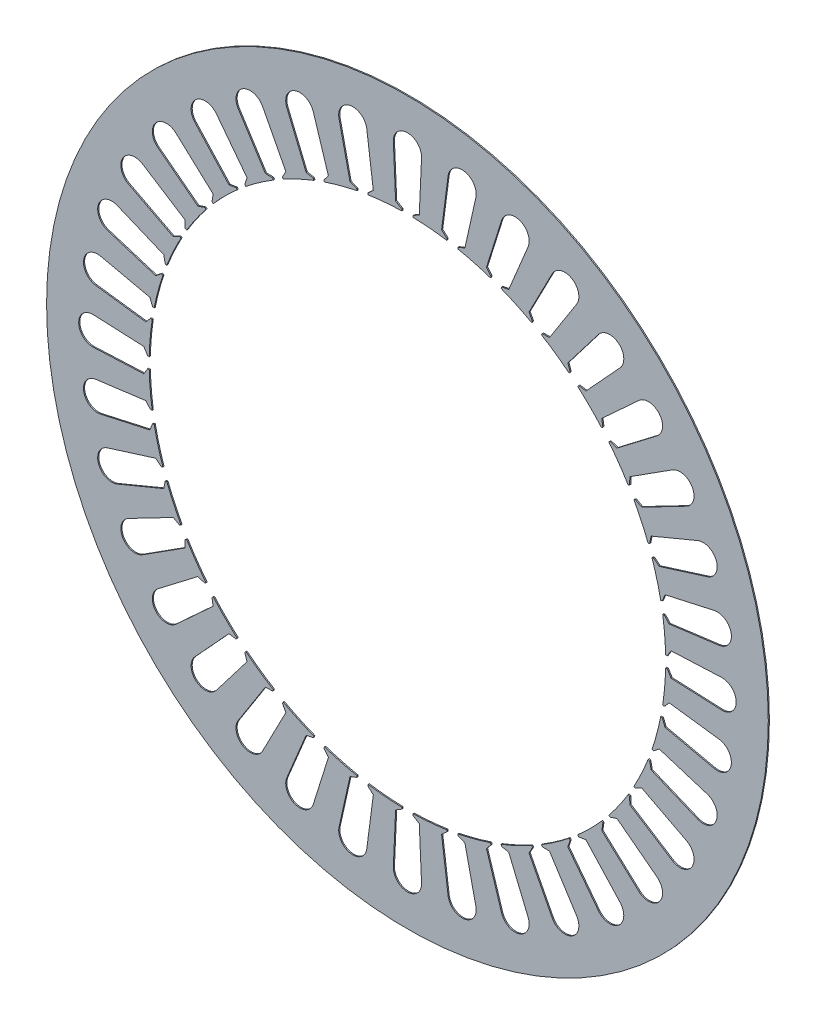
from build123d import *

# Parameters (mm, degrees)
STATOR_SKETCH_R     = 64
BOSS_EXTRUDE1_DEPTH = 0.1


with BuildPart() as part:
    # Stator sketch → Boss-Extrude1 (new, symmetric)
    with BuildSketch(Plane.XY):
        Circle(STATOR_SKETCH_R)
        with BuildLine():
            Line((2.098931216, 46.753917075), (2.5, 55.687767093))
            ThreePointArc((2.5, 55.687767093), (0, 58.302517977), (-2.5, 55.687767093))
            Line((-2.5, 55.687767093), (-2.098931216, 46.753917075))
            Line((-2.098931216, 46.753917075), (-1.00655178, 46.089081668))
            Line((-1.00655178, 46.089081668), (-1, 45.789081668))
            ThreePointArc((-1, 45.789081668), (-3.991733018, 45.625717173), (-6.966382836, 45.267090808))
            Line((-6.966382836, 45.267090808), (-7.012025045, 45.563670838))
            Line((-7.012025045, 45.563670838), (-6.051688764, 46.4080956))
            Line((-6.051688764, 46.4080956), (-7.208059891, 55.275865225))
            ThreePointArc((-7.208059891, 55.275865225), (-10.124126, 57.416771724), (-12.132098657, 54.407624337))
            Line((-12.132098657, 54.407624337), (-10.185776233, 45.679144438))
            Line((-10.185776233, 45.679144438), (-8.994545039, 45.214099074))
            Line((-8.994545039, 45.214099074), (-8.935998342, 44.919794452))
            ThreePointArc((-8.935998342, 44.919794452), (-11.853912266, 44.239402844), (-14.721095654, 43.369682299))
            Line((-14.721095654, 43.369682299), (-14.817545038, 43.653830926))
            Line((-14.817545038, 43.653830926), (-14.018431244, 44.652187623))
            Line((-14.018431244, 44.652187623), (-16.697106531, 53.184434163))
            ThreePointArc((-16.697106531, 53.184434163), (-19.940635555, 54.786445916), (-21.395569635, 51.474333447))
            Line((-21.395569635, 51.474333447), (-17.963131594, 43.216434113))
            Line((-17.963131594, 43.216434113), (-16.709243598, 42.965308958))
            Line((-16.709243598, 42.965308958), (-16.600480896, 42.685642013))
            ThreePointArc((-16.600480896, 42.685642013), (-19.355916388, 41.508896646), (-22.02851543, 40.15450794))
            Line((-22.02851543, 40.15450794), (-22.172841422, 40.417591452))
            Line((-22.172841422, 40.417591452), (-21.559230784, 41.539545521))
            Line((-21.559230784, 41.539545521), (-25.678820037, 49.477020982))
            ThreePointArc((-25.678820037, 49.477020982), (-29.151258989, 50.491461673), (-30.008947056, 46.977020982))
            Line((-30.008947056, 46.977020982), (-25.194686291, 39.440614305))
            Line((-25.194686291, 39.440614305), (-23.916240246, 39.411039671))
            Line((-23.916240246, 39.411039671), (-23.760566238, 39.15450794))
            ThreePointArc((-23.760566238, 39.15450794), (-26.269800785, 37.517163628), (-28.666609912, 35.719259177))
            Line((-28.666609912, 35.719259177), (-28.85442724, 35.953283913))
            Line((-28.85442724, 35.953283913), (-28.444964006, 37.164745348))
            Line((-28.444964006, 37.164745348), (-33.880295591, 44.266273555))
            ThreePointArc((-33.880295591, 44.266273555), (-37.476136169, 44.662319916), (-37.710517806, 41.052335507))
            Line((-37.710517806, 41.052335507), (-31.660713194, 34.46641139))
            Line((-31.660713194, 34.46641139), (-30.396554036, 34.659285887))
            Line((-30.396554036, 34.659285887), (-30.198698798, 34.433683958))
            ThreePointArc((-30.198698798, 34.433683958), (-32.385490578, 32.385490578), (-34.433683958, 30.198698798))
            Line((-34.433683958, 30.198698798), (-34.659285887, 30.396554036))
            Line((-34.659285887, 30.396554036), (-34.46641139, 31.660713194))
            Line((-34.46641139, 31.660713194), (-41.052335507, 37.710517806))
            ThreePointArc((-41.052335507, 37.710517806), (-44.662319916, 37.476136169), (-44.266273555, 33.880295591))
            Line((-44.266273555, 33.880295591), (-37.164745348, 28.444964006))
            Line((-37.164745348, 28.444964006), (-35.953283913, 28.85442724))
            Line((-35.953283913, 28.85442724), (-35.719259177, 28.666609912))
            ThreePointArc((-35.719259177, 28.666609912), (-37.517163628, 26.269800785), (-39.15450794, 23.760566238))
            Line((-39.15450794, 23.760566238), (-39.411039671, 23.916240246))
            Line((-39.411039671, 23.916240246), (-39.440614305, 25.194686291))
            Line((-39.440614305, 25.194686291), (-46.977020982, 30.008947056))
            ThreePointArc((-46.977020982, 30.008947056), (-50.491461673, 29.151258989), (-49.477020982, 25.678820037))
            Line((-49.477020982, 25.678820037), (-41.539545521, 21.559230784))
            Line((-41.539545521, 21.559230784), (-40.417591452, 22.172841422))
            Line((-40.417591452, 22.172841422), (-40.15450794, 22.02851543))
            ThreePointArc((-40.15450794, 22.02851543), (-41.508896646, 19.355916388), (-42.685642013, 16.600480896))
            Line((-42.685642013, 16.600480896), (-42.965308958, 16.709243598))
            Line((-42.965308958, 16.709243598), (-43.216434113, 17.963131594))
            Line((-43.216434113, 17.963131594), (-51.474333447, 21.395569635))
            ThreePointArc((-51.474333447, 21.395569635), (-54.786445916, 19.940635555), (-53.184434163, 16.697106531))
            Line((-53.184434163, 16.697106531), (-44.652187623, 14.018431244))
            Line((-44.652187623, 14.018431244), (-43.653830926, 14.817545038))
            Line((-43.653830926, 14.817545038), (-43.369682299, 14.721095654))
            ThreePointArc((-43.369682299, 14.721095654), (-44.239402844, 11.853912266), (-44.919794452, 8.935998342))
            Line((-44.919794452, 8.935998342), (-45.214099074, 8.994545039))
            Line((-45.214099074, 8.994545039), (-45.679144438, 10.185776233))
            Line((-45.679144438, 10.185776233), (-54.407624337, 12.132098657))
            ThreePointArc((-54.407624337, 12.132098657), (-57.416771724, 10.124126), (-55.275865225, 7.208059891))
            Line((-55.275865225, 7.208059891), (-46.4080956, 6.051688764))
            Line((-46.4080956, 6.051688764), (-45.563670838, 7.012025045))
            Line((-45.563670838, 7.012025045), (-45.267090808, 6.966382836))
            ThreePointArc((-45.267090808, 6.966382836), (-45.625717173, 3.991733018), (-45.789081668, 1))
            Line((-45.789081668, 1), (-46.089081668, 1.00655178))
            Line((-46.089081668, 1.00655178), (-46.753917075, 2.098931216))
            Line((-46.753917075, 2.098931216), (-55.687767093, 2.5))
            ThreePointArc((-55.687767093, 2.5), (-58.302517977, 0), (-55.687767093, -2.5))
            Line((-55.687767093, -2.5), (-46.753917075, -2.098931216))
            Line((-46.753917075, -2.098931216), (-46.089081668, -1.00655178))
            Line((-46.089081668, -1.00655178), (-45.789081668, -1))
            ThreePointArc((-45.789081668, -1), (-45.625717173, -3.991733018), (-45.267090808, -6.966382836))
            Line((-45.267090808, -6.966382836), (-45.563670838, -7.012025045))
            Line((-45.563670838, -7.012025045), (-46.4080956, -6.051688764))
            Line((-46.4080956, -6.051688764), (-55.275865225, -7.208059891))
            ThreePointArc((-55.275865225, -7.208059891), (-57.416771724, -10.124126), (-54.407624337, -12.132098657))
            Line((-54.407624337, -12.132098657), (-45.679144438, -10.185776233))
            Line((-45.679144438, -10.185776233), (-45.214099074, -8.994545039))
            Line((-45.214099074, -8.994545039), (-44.919794452, -8.935998342))
            ThreePointArc((-44.919794452, -8.935998342), (-44.239402844, -11.853912266), (-43.369682299, -14.721095654))
            Line((-43.369682299, -14.721095654), (-43.653830926, -14.817545038))
            Line((-43.653830926, -14.817545038), (-44.652187623, -14.018431244))
            Line((-44.652187623, -14.018431244), (-53.184434163, -16.697106531))
            ThreePointArc((-53.184434163, -16.697106531), (-54.786445916, -19.940635555), (-51.474333447, -21.395569635))
            Line((-51.474333447, -21.395569635), (-43.216434113, -17.963131594))
            Line((-43.216434113, -17.963131594), (-42.965308958, -16.709243598))
            Line((-42.965308958, -16.709243598), (-42.685642013, -16.600480896))
            ThreePointArc((-42.685642013, -16.600480896), (-41.508896646, -19.355916388), (-40.15450794, -22.02851543))
            Line((-40.15450794, -22.02851543), (-40.417591452, -22.172841422))
            Line((-40.417591452, -22.172841422), (-41.539545521, -21.559230784))
            Line((-41.539545521, -21.559230784), (-49.477020982, -25.678820037))
            ThreePointArc((-49.477020982, -25.678820037), (-50.491461673, -29.151258989), (-46.977020982, -30.008947056))
            Line((-46.977020982, -30.008947056), (-39.440614305, -25.194686291))
            Line((-39.440614305, -25.194686291), (-39.411039671, -23.916240246))
            Line((-39.411039671, -23.916240246), (-39.15450794, -23.760566238))
            ThreePointArc((-39.15450794, -23.760566238), (-37.517163628, -26.269800785), (-35.719259177, -28.666609912))
            Line((-35.719259177, -28.666609912), (-35.953283913, -28.85442724))
            Line((-35.953283913, -28.85442724), (-37.164745348, -28.444964006))
            Line((-37.164745348, -28.444964006), (-44.266273555, -33.880295591))
            ThreePointArc((-44.266273555, -33.880295591), (-44.662319916, -37.476136169), (-41.052335507, -37.710517806))
            Line((-41.052335507, -37.710517806), (-34.46641139, -31.660713194))
            Line((-34.46641139, -31.660713194), (-34.659285887, -30.396554036))
            Line((-34.659285887, -30.396554036), (-34.433683958, -30.198698798))
            ThreePointArc((-34.433683958, -30.198698798), (-32.385490578, -32.385490578), (-30.198698798, -34.433683958))
            Line((-30.198698798, -34.433683958), (-30.396554036, -34.659285887))
            Line((-30.396554036, -34.659285887), (-31.660713194, -34.46641139))
            Line((-31.660713194, -34.46641139), (-37.710517806, -41.052335507))
            ThreePointArc((-37.710517806, -41.052335507), (-37.476136169, -44.662319916), (-33.880295591, -44.266273555))
            Line((-33.880295591, -44.266273555), (-28.444964006, -37.164745348))
            Line((-28.444964006, -37.164745348), (-28.85442724, -35.953283913))
            Line((-28.85442724, -35.953283913), (-28.666609912, -35.719259177))
            ThreePointArc((-28.666609912, -35.719259177), (-26.269800785, -37.517163628), (-23.760566238, -39.15450794))
            Line((-23.760566238, -39.15450794), (-23.916240246, -39.411039671))
            Line((-23.916240246, -39.411039671), (-25.194686291, -39.440614305))
            Line((-25.194686291, -39.440614305), (-30.008947056, -46.977020982))
            ThreePointArc((-30.008947056, -46.977020982), (-29.151258989, -50.491461673), (-25.678820037, -49.477020982))
            Line((-25.678820037, -49.477020982), (-21.559230784, -41.539545521))
            Line((-21.559230784, -41.539545521), (-22.172841422, -40.417591452))
            Line((-22.172841422, -40.417591452), (-22.02851543, -40.15450794))
            ThreePointArc((-22.02851543, -40.15450794), (-19.355916388, -41.508896646), (-16.600480896, -42.685642013))
            Line((-16.600480896, -42.685642013), (-16.709243598, -42.965308958))
            Line((-16.709243598, -42.965308958), (-17.963131594, -43.216434113))
            Line((-17.963131594, -43.216434113), (-21.395569635, -51.474333447))
            ThreePointArc((-21.395569635, -51.474333447), (-19.940635555, -54.786445916), (-16.697106531, -53.184434163))
            Line((-16.697106531, -53.184434163), (-14.018431244, -44.652187623))
            Line((-14.018431244, -44.652187623), (-14.817545038, -43.653830926))
            Line((-14.817545038, -43.653830926), (-14.721095654, -43.369682299))
            ThreePointArc((-14.721095654, -43.369682299), (-11.853912266, -44.239402844), (-8.935998342, -44.919794452))
            Line((-8.935998342, -44.919794452), (-8.994545039, -45.214099074))
            Line((-8.994545039, -45.214099074), (-10.185776233, -45.679144438))
            Line((-10.185776233, -45.679144438), (-12.132098657, -54.407624337))
            ThreePointArc((-12.132098657, -54.407624337), (-10.124126, -57.416771724), (-7.208059891, -55.275865225))
            Line((-7.208059891, -55.275865225), (-6.051688764, -46.4080956))
            Line((-6.051688764, -46.4080956), (-7.012025045, -45.563670838))
            Line((-7.012025045, -45.563670838), (-6.966382836, -45.267090808))
            ThreePointArc((-6.966382836, -45.267090808), (-3.991733018, -45.625717173), (-1, -45.789081668))
            Line((-1, -45.789081668), (-1.00655178, -46.089081668))
            Line((-1.00655178, -46.089081668), (-2.098931216, -46.753917075))
            Line((-2.098931216, -46.753917075), (-2.5, -55.687767093))
            ThreePointArc((-2.5, -55.687767093), (0, -58.302517977), (2.5, -55.687767093))
            Line((2.5, -55.687767093), (2.098931216, -46.753917075))
            Line((2.098931216, -46.753917075), (1.00655178, -46.089081668))
            Line((1.00655178, -46.089081668), (1, -45.789081668))
            ThreePointArc((1, -45.789081668), (3.991733018, -45.625717173), (6.966382836, -45.267090808))
            Line((6.966382836, -45.267090808), (7.012025045, -45.563670838))
            Line((7.012025045, -45.563670838), (6.051688764, -46.4080956))
            Line((6.051688764, -46.4080956), (7.208059891, -55.275865225))
            ThreePointArc((7.208059891, -55.275865225), (10.124126, -57.416771724), (12.132098657, -54.407624337))
            Line((12.132098657, -54.407624337), (10.185776233, -45.679144438))
            Line((10.185776233, -45.679144438), (8.994545039, -45.214099074))
            Line((8.994545039, -45.214099074), (8.935998342, -44.919794452))
            ThreePointArc((8.935998342, -44.919794452), (11.853912266, -44.239402844), (14.721095654, -43.369682299))
            Line((14.721095654, -43.369682299), (14.817545038, -43.653830926))
            Line((14.817545038, -43.653830926), (14.018431244, -44.652187623))
            Line((14.018431244, -44.652187623), (16.697106531, -53.184434163))
            ThreePointArc((16.697106531, -53.184434163), (19.940635555, -54.786445916), (21.395569635, -51.474333447))
            Line((21.395569635, -51.474333447), (17.963131594, -43.216434113))
            Line((17.963131594, -43.216434113), (16.709243598, -42.965308958))
            Line((16.709243598, -42.965308958), (16.600480896, -42.685642013))
            ThreePointArc((16.600480896, -42.685642013), (19.355916388, -41.508896646), (22.02851543, -40.15450794))
            Line((22.02851543, -40.15450794), (22.172841422, -40.417591452))
            Line((22.172841422, -40.417591452), (21.559230784, -41.539545521))
            Line((21.559230784, -41.539545521), (25.678820037, -49.477020982))
            ThreePointArc((25.678820037, -49.477020982), (29.151258989, -50.491461673), (30.008947056, -46.977020982))
            Line((30.008947056, -46.977020982), (25.194686291, -39.440614305))
            Line((25.194686291, -39.440614305), (23.916240246, -39.411039671))
            Line((23.916240246, -39.411039671), (23.760566238, -39.15450794))
            ThreePointArc((23.760566238, -39.15450794), (26.269800785, -37.517163628), (28.666609912, -35.719259177))
            Line((28.666609912, -35.719259177), (28.85442724, -35.953283913))
            Line((28.85442724, -35.953283913), (28.444964006, -37.164745348))
            Line((28.444964006, -37.164745348), (33.880295591, -44.266273555))
            ThreePointArc((33.880295591, -44.266273555), (37.476136169, -44.662319916), (37.710517806, -41.052335507))
            Line((37.710517806, -41.052335507), (31.660713194, -34.46641139))
            Line((31.660713194, -34.46641139), (30.396554036, -34.659285887))
            Line((30.396554036, -34.659285887), (30.198698798, -34.433683958))
            ThreePointArc((30.198698798, -34.433683958), (32.385490578, -32.385490578), (34.433683958, -30.198698798))
            Line((34.433683958, -30.198698798), (34.659285887, -30.396554036))
            Line((34.659285887, -30.396554036), (34.46641139, -31.660713194))
            Line((34.46641139, -31.660713194), (41.052335507, -37.710517806))
            ThreePointArc((41.052335507, -37.710517806), (44.662319916, -37.476136169), (44.266273555, -33.880295591))
            Line((44.266273555, -33.880295591), (37.164745348, -28.444964006))
            Line((37.164745348, -28.444964006), (35.953283913, -28.85442724))
            Line((35.953283913, -28.85442724), (35.719259177, -28.666609912))
            ThreePointArc((35.719259177, -28.666609912), (37.517163628, -26.269800785), (39.15450794, -23.760566238))
            Line((39.15450794, -23.760566238), (39.411039671, -23.916240246))
            Line((39.411039671, -23.916240246), (39.440614305, -25.194686291))
            Line((39.440614305, -25.194686291), (46.977020982, -30.008947056))
            ThreePointArc((46.977020982, -30.008947056), (50.491461673, -29.151258989), (49.477020982, -25.678820037))
            Line((49.477020982, -25.678820037), (41.539545521, -21.559230784))
            Line((41.539545521, -21.559230784), (40.417591452, -22.172841422))
            Line((40.417591452, -22.172841422), (40.15450794, -22.02851543))
            ThreePointArc((40.15450794, -22.02851543), (41.508896646, -19.355916388), (42.685642013, -16.600480896))
            Line((42.685642013, -16.600480896), (42.965308958, -16.709243598))
            Line((42.965308958, -16.709243598), (43.216434113, -17.963131594))
            Line((43.216434113, -17.963131594), (51.474333447, -21.395569635))
            ThreePointArc((51.474333447, -21.395569635), (54.786445916, -19.940635555), (53.184434163, -16.697106531))
            Line((53.184434163, -16.697106531), (44.652187623, -14.018431244))
            Line((44.652187623, -14.018431244), (43.653830926, -14.817545038))
            Line((43.653830926, -14.817545038), (43.369682299, -14.721095654))
            ThreePointArc((43.369682299, -14.721095654), (44.239402844, -11.853912266), (44.919794452, -8.935998342))
            Line((44.919794452, -8.935998342), (45.214099074, -8.994545039))
            Line((45.214099074, -8.994545039), (45.679144438, -10.185776233))
            Line((45.679144438, -10.185776233), (54.407624337, -12.132098657))
            ThreePointArc((54.407624337, -12.132098657), (57.416771724, -10.124126), (55.275865225, -7.208059891))
            Line((55.275865225, -7.208059891), (46.4080956, -6.051688764))
            Line((46.4080956, -6.051688764), (45.563670838, -7.012025045))
            Line((45.563670838, -7.012025045), (45.267090808, -6.966382836))
            ThreePointArc((45.267090808, -6.966382836), (45.625717173, -3.991733018), (45.789081668, -1))
            Line((45.789081668, -1), (46.089081668, -1.00655178))
            Line((46.089081668, -1.00655178), (46.753917075, -2.098931216))
            Line((46.753917075, -2.098931216), (55.687767093, -2.5))
            ThreePointArc((55.687767093, -2.5), (58.302517977, 0), (55.687767093, 2.5))
            Line((55.687767093, 2.5), (46.753917075, 2.098931216))
            Line((46.753917075, 2.098931216), (46.089081668, 1.00655178))
            Line((46.089081668, 1.00655178), (45.789081668, 1))
            ThreePointArc((45.789081668, 1), (45.625717173, 3.991733018), (45.267090808, 6.966382836))
            Line((45.267090808, 6.966382836), (45.563670838, 7.012025045))
            Line((45.563670838, 7.012025045), (46.4080956, 6.051688764))
            Line((46.4080956, 6.051688764), (55.275865225, 7.208059891))
            ThreePointArc((55.275865225, 7.208059891), (57.416771724, 10.124126), (54.407624337, 12.132098657))
            Line((54.407624337, 12.132098657), (45.679144438, 10.185776233))
            Line((45.679144438, 10.185776233), (45.214099074, 8.994545039))
            Line((45.214099074, 8.994545039), (44.919794452, 8.935998342))
            ThreePointArc((44.919794452, 8.935998342), (44.239402844, 11.853912266), (43.369682299, 14.721095654))
            Line((43.369682299, 14.721095654), (43.653830926, 14.817545038))
            Line((43.653830926, 14.817545038), (44.652187623, 14.018431244))
            Line((44.652187623, 14.018431244), (53.184434163, 16.697106531))
            ThreePointArc((53.184434163, 16.697106531), (54.786445916, 19.940635555), (51.474333447, 21.395569635))
            Line((51.474333447, 21.395569635), (43.216434113, 17.963131594))
            Line((43.216434113, 17.963131594), (42.965308958, 16.709243598))
            Line((42.965308958, 16.709243598), (42.685642013, 16.600480896))
            ThreePointArc((42.685642013, 16.600480896), (41.508896646, 19.355916388), (40.15450794, 22.02851543))
            Line((40.15450794, 22.02851543), (40.417591452, 22.172841422))
            Line((40.417591452, 22.172841422), (41.539545521, 21.559230784))
            Line((41.539545521, 21.559230784), (49.477020982, 25.678820037))
            ThreePointArc((49.477020982, 25.678820037), (50.491461673, 29.151258989), (46.977020982, 30.008947056))
            Line((46.977020982, 30.008947056), (39.440614305, 25.194686291))
            Line((39.440614305, 25.194686291), (39.411039671, 23.916240246))
            Line((39.411039671, 23.916240246), (39.15450794, 23.760566238))
            ThreePointArc((39.15450794, 23.760566238), (37.517163628, 26.269800785), (35.719259177, 28.666609912))
            Line((35.719259177, 28.666609912), (35.953283913, 28.85442724))
            Line((35.953283913, 28.85442724), (37.164745348, 28.444964006))
            Line((37.164745348, 28.444964006), (44.266273555, 33.880295591))
            ThreePointArc((44.266273555, 33.880295591), (44.662319916, 37.476136169), (41.052335507, 37.710517806))
            Line((41.052335507, 37.710517806), (34.46641139, 31.660713194))
            Line((34.46641139, 31.660713194), (34.659285887, 30.396554036))
            Line((34.659285887, 30.396554036), (34.433683958, 30.198698798))
            ThreePointArc((34.433683958, 30.198698798), (32.385490578, 32.385490578), (30.198698798, 34.433683958))
            Line((30.198698798, 34.433683958), (30.396554036, 34.659285887))
            Line((30.396554036, 34.659285887), (31.660713194, 34.46641139))
            Line((31.660713194, 34.46641139), (37.710517806, 41.052335507))
            ThreePointArc((37.710517806, 41.052335507), (37.476136169, 44.662319916), (33.880295591, 44.266273555))
            Line((33.880295591, 44.266273555), (28.444964006, 37.164745348))
            Line((28.444964006, 37.164745348), (28.85442724, 35.953283913))
            Line((28.85442724, 35.953283913), (28.666609912, 35.719259177))
            ThreePointArc((28.666609912, 35.719259177), (26.269800785, 37.517163628), (23.760566238, 39.15450794))
            Line((23.760566238, 39.15450794), (23.916240246, 39.411039671))
            Line((23.916240246, 39.411039671), (25.194686291, 39.440614305))
            Line((25.194686291, 39.440614305), (30.008947056, 46.977020982))
            ThreePointArc((30.008947056, 46.977020982), (29.151258989, 50.491461673), (25.678820037, 49.477020982))
            Line((25.678820037, 49.477020982), (21.559230784, 41.539545521))
            Line((21.559230784, 41.539545521), (22.172841422, 40.417591452))
            Line((22.172841422, 40.417591452), (22.02851543, 40.15450794))
            ThreePointArc((22.02851543, 40.15450794), (19.355916388, 41.508896646), (16.600480896, 42.685642013))
            Line((16.600480896, 42.685642013), (16.709243598, 42.965308958))
            Line((16.709243598, 42.965308958), (17.963131594, 43.216434113))
            Line((17.963131594, 43.216434113), (21.395569635, 51.474333447))
            ThreePointArc((21.395569635, 51.474333447), (19.940635555, 54.786445916), (16.697106531, 53.184434163))
            Line((16.697106531, 53.184434163), (14.018431244, 44.652187623))
            Line((14.018431244, 44.652187623), (14.817545038, 43.653830926))
            Line((14.817545038, 43.653830926), (14.721095654, 43.369682299))
            ThreePointArc((14.721095654, 43.369682299), (11.853912266, 44.239402844), (8.935998342, 44.919794452))
            Line((8.935998342, 44.919794452), (8.994545039, 45.214099074))
            Line((8.994545039, 45.214099074), (10.185776233, 45.679144438))
            Line((10.185776233, 45.679144438), (12.132098657, 54.407624337))
            ThreePointArc((12.132098657, 54.407624337), (10.124126, 57.416771724), (7.208059891, 55.275865225))
            Line((7.208059891, 55.275865225), (6.051688764, 46.4080956))
            Line((6.051688764, 46.4080956), (7.012025045, 45.563670838))
            Line((7.012025045, 45.563670838), (6.966382836, 45.267090808))
            ThreePointArc((6.966382836, 45.267090808), (3.991733018, 45.625717173), (1, 45.789081668))
            Line((1, 45.789081668), (1.00655178, 46.089081668))
            Line((1.00655178, 46.089081668), (2.098931216, 46.753917075))
        make_face(mode=Mode.SUBTRACT)
    extrude(amount=BOSS_EXTRUDE1_DEPTH, both=True)


solid = part.part
